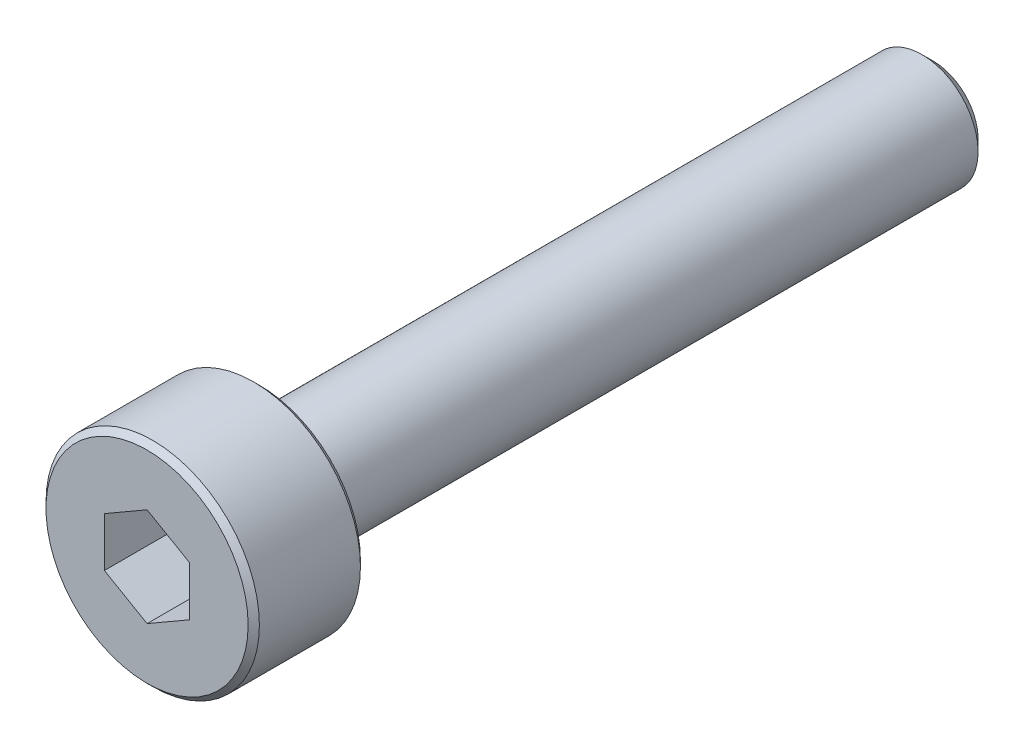
from build123d import *

# Parameters (mm, degrees)
SKETCH_1_W          = 1.9
SKETCH_1_H          = 2
SKETCH_2_R          = 1
EXTRUDE_1_DEPTH     = 12
CUT_EXTRUDE_1_DEPTH = 1.5
CHAMFER_1_SIZE2     = 0.100000822
CHAMFER_1_SIZE      = 0.100000763
CHAMFER_2_SIZE      = 0.200008364
CHAMFER_2_SIZE2     = 0.200010455


with BuildPart() as part:
    # 草图1 → 旋转1 (revolve)
    with BuildSketch(Plane(origin=(0, 0, 0), x_dir=(1, 0, 0), z_dir=(0, 1, 0))):
        with Locations((0.95, -11)):
            Rectangle(SKETCH_1_W, SKETCH_1_H)
    revolve(axis=Axis((0, 0, 10), (0, 0, 1)))

    # 草图2 → 凸台-拉伸1 (add)
    with BuildSketch(Plane(origin=(0, 0, 10), x_dir=(-1, 0, 0), z_dir=(0, 0, -1))):
        Circle(SKETCH_2_R)
    extrude(amount=EXTRUDE_1_DEPTH)

    # 草图3 → 切除-拉伸1 (cut)
    with BuildSketch(Plane.XY.offset(12)):
        Polygon((-0.76, -0.438786205), (0, -0.877572409), (0.76, -0.438786205), (0.76, 0.438786205), (0, 0.877572409), (-0.76, 0.438786205), align=None)
    extrude(amount=-CUT_EXTRUDE_1_DEPTH, mode=Mode.SUBTRACT)

    # 倒角1
    chamfer_1_edges = [part.edges().sort_by_distance(p)[0] for p in [
        (-1.9, 0, 12),
        (-1.9, 0, 10),
    ]]
    chamfer(chamfer_1_edges, length=CHAMFER_1_SIZE, length2=CHAMFER_1_SIZE2)

    # 倒角2
    chamfer_2_edges = [part.edges().sort_by_distance(p)[0] for p in [
        (1, 0, -2),
    ]]
    chamfer_2_side = [part.faces().sort_by_distance(p)[0] for p in [
        (1, 0, 4),
    ]]
    chamfer(chamfer_2_edges, length=CHAMFER_2_SIZE, length2=CHAMFER_2_SIZE2, reference=chamfer_2_side[0])


solid = part.part
